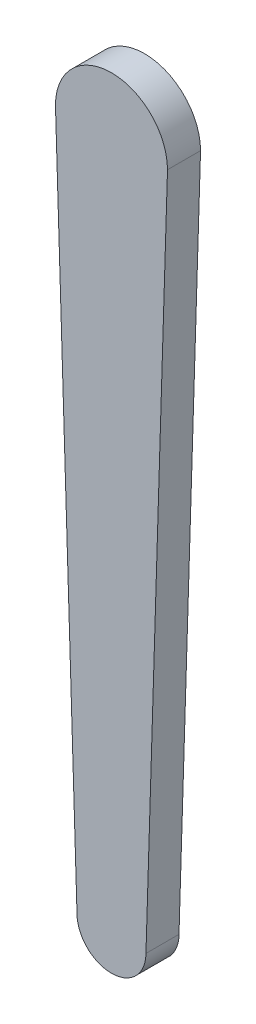
from build123d import *

# Parameters (mm, degrees)
EXTRUDE_1_DEPTH = 11.5


with BuildPart() as part:
    # 草图1 → 凸台-拉伸1 (new body)
    with BuildSketch(Plane.XY):
        with BuildLine():
            Line((12, -120), (19.5, 120))
            ThreePointArc((19.5, 120), (0, 139.5), (-19.5, 120))
            Line((-19.5, 120), (-12, -120))
            ThreePointArc((-12, -120), (0, -132), (12, -120))
        make_face()
    extrude(amount=EXTRUDE_1_DEPTH)


solid = part.part
